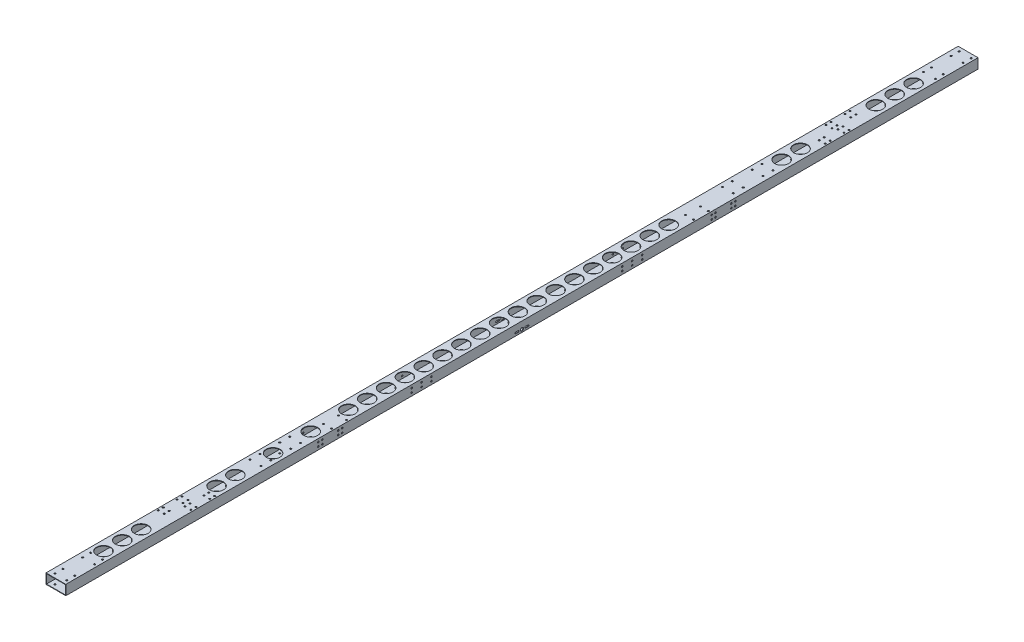
from build123d import *

# Parameters (mm, degrees)
SKETCH_1_W          = 40
SKETCH_1_H          = 20
SKETCH_1_W_2        = 38
SKETCH_1_H_2        = 18
EXTRUDE_1_DEPTH     = 1840
SKETCH_2_R          = 1.6
CUT_EXTRUDE_1_DEPTH = 1841.543398021
SKETCH_3_R          = 1.6
CUT_EXTRUDE_2_DEPTH = 1841.543398021
SKETCH_4_R          = 3.1
CUT_EXTRUDE_3_DEPTH = 1841.543398021
SKETCH_5_R          = 1.6
CUT_EXTRUDE_4_DEPTH = 1841.543398021
SKETCH_6_R          = 14
CUT_EXTRUDE_5_DEPTH = 1841.543398021


with BuildPart() as part:
    # 草图1 → 凸台-拉伸1 (new body)
    with BuildSketch(Plane.XY):
        with Locations((20, 10)):
            Rectangle(SKETCH_1_W, SKETCH_1_H)
        with Locations((20, 10)):
            Rectangle(SKETCH_1_W_2, SKETCH_1_H_2, mode=Mode.SUBTRACT)
    extrude(amount=EXTRUDE_1_DEPTH)

    # 草图2 → 切除-拉伸1 (cut, through all)
    with BuildSketch(Plane.XZ):
        with Locations(Location((34, 8, 0), (0, 0, 270))):
            Circle(SKETCH_2_R)
        with Locations(Location((34, 24, 0), (0, 0, 270))):
            Circle(SKETCH_2_R)
        with Locations(Location((34, 64, 0), (0, 0, 270))):
            Circle(SKETCH_2_R)
        with Locations(Location((34, 80, 0), (0, 0, 270))):
            Circle(SKETCH_2_R)
        with Locations(Location((10, 64, 0), (0, 0, 270))):
            Circle(SKETCH_2_R)
        with Locations(Location((10, 80, 0), (0, 0, 270))):
            Circle(SKETCH_2_R)
        with Locations(Location((10, 24, 0), (0, 0, 270))):
            Circle(SKETCH_2_R)
        with Locations(Location((10, 8, 0), (0, 0, 270))):
            Circle(SKETCH_2_R)
        with Locations(Location((4, 232.506350946, 0), (0, 0, 270))):
            Circle(SKETCH_2_R)
        with Locations(Location((16, 270.506350946, 0), (0, 0, 270))):
            Circle(SKETCH_2_R)
        with Locations(Location((4, 270.506350946, 0), (0, 0, 270))):
            Circle(SKETCH_2_R)
        with Locations(Location((16, 222.506350946, 0), (0, 0, 270))):
            Circle(SKETCH_2_R)
        with Locations(Location((4, 222.506350946, 0), (0, 0, 270))):
            Circle(SKETCH_2_R)
        with Locations(Location((16, 260.506350946, 0), (0, 0, 270))):
            Circle(SKETCH_2_R)
        with Locations(Location((4, 260.506350946, 0), (0, 0, 270))):
            Circle(SKETCH_2_R)
        with Locations(Location((16, 232.506350946, 0), (0, 0, 270))):
            Circle(SKETCH_2_R)
        with Locations(Location((8, 483.5, 0), (0, 0, 270))):
            Circle(SKETCH_2_R)
        with Locations(Location((30, 483.5, 0), (0, 0, 270))):
            Circle(SKETCH_2_R)
        with Locations(Location((30, 463.5, 0), (0, 0, 270))):
            Circle(SKETCH_2_R)
        with Locations(Location((30, 423.5, 0), (0, 0, 270))):
            Circle(SKETCH_2_R)
        with Locations(Location((8, 403.5, 0), (0, 0, 270))):
            Circle(SKETCH_2_R)
        with Locations(Location((30, 403.5, 0), (0, 0, 270))):
            Circle(SKETCH_2_R)
        with Locations(Location((8, 423.5, 0), (0, 0, 270))):
            Circle(SKETCH_2_R)
        with Locations(Location((8, 463.5, 0), (0, 0, 270))):
            Circle(SKETCH_2_R)
        with Locations(Location((8, 1436.5, 0), (0, 0, 270))):
            Circle(SKETCH_2_R)
        with Locations(Location((30, 1436.5, 0), (0, 0, 270))):
            Circle(SKETCH_2_R)
        with Locations(Location((30, 1416.5, 0), (0, 0, 270))):
            Circle(SKETCH_2_R)
        with Locations(Location((30, 1376.5, 0), (0, 0, 270))):
            Circle(SKETCH_2_R)
        with Locations(Location((8, 1356.5, 0), (0, 0, 270))):
            Circle(SKETCH_2_R)
        with Locations(Location((30, 1356.5, 0), (0, 0, 270))):
            Circle(SKETCH_2_R)
        with Locations(Location((8, 1376.5, 0), (0, 0, 270))):
            Circle(SKETCH_2_R)
        with Locations(Location((8, 1416.5, 0), (0, 0, 270))):
            Circle(SKETCH_2_R)
        with Locations(Location((4, 1607.493649054, 0), (0, 0, 270))):
            Circle(SKETCH_2_R)
        with Locations(Location((16, 1569.493649054, 0), (0, 0, 270))):
            Circle(SKETCH_2_R)
        with Locations(Location((4, 1569.493649054, 0), (0, 0, 270))):
            Circle(SKETCH_2_R)
        with Locations(Location((16, 1617.493649054, 0), (0, 0, 270))):
            Circle(SKETCH_2_R)
        with Locations(Location((4, 1617.493649054, 0), (0, 0, 270))):
            Circle(SKETCH_2_R)
        with Locations(Location((16, 1579.493649054, 0), (0, 0, 270))):
            Circle(SKETCH_2_R)
        with Locations(Location((4, 1579.493649054, 0), (0, 0, 270))):
            Circle(SKETCH_2_R)
        with Locations(Location((16, 1607.493649054, 0), (0, 0, 270))):
            Circle(SKETCH_2_R)
        with Locations(Location((34, 1832, 0), (0, 0, 270))):
            Circle(SKETCH_2_R)
        with Locations(Location((34, 1816, 0), (0, 0, 270))):
            Circle(SKETCH_2_R)
        with Locations(Location((34, 1776, 0), (0, 0, 270))):
            Circle(SKETCH_2_R)
        with Locations(Location((34, 1760, 0), (0, 0, 270))):
            Circle(SKETCH_2_R)
        with Locations(Location((10, 1776, 0), (0, 0, 270))):
            Circle(SKETCH_2_R)
        with Locations(Location((10, 1760, 0), (0, 0, 270))):
            Circle(SKETCH_2_R)
        with Locations(Location((10, 1816, 0), (0, 0, 270))):
            Circle(SKETCH_2_R)
        with Locations(Location((10, 1832, 0), (0, 0, 270))):
            Circle(SKETCH_2_R)
    extrude(amount=-CUT_EXTRUDE_1_DEPTH, mode=Mode.SUBTRACT)

    # 草图3 → 切除-拉伸2 (cut, through all)
    with BuildSketch(Plane.XZ):
        with Locations(Location((20, 1270, 0), (0, 0, 270))):
            Circle(SKETCH_3_R)
        with Locations(Location((20, 1300, 0), (0, 0, 270))):
            Circle(SKETCH_3_R)
        with Locations(Location((36, 1300, 0), (0, 0, 270))):
            Circle(SKETCH_3_R)
        with Locations(Location((36, 294.294919243, 0), (0, 0, 270))):
            Circle(SKETCH_3_R)
        with Locations(Location((24, 256.294919243, 0), (0, 0, 270))):
            Circle(SKETCH_3_R)
        with Locations(Location((36, 256.294919243, 0), (0, 0, 270))):
            Circle(SKETCH_3_R)
        with Locations(Location((24, 304.294919243, 0), (0, 0, 270))):
            Circle(SKETCH_3_R)
        with Locations(Location((36, 304.294919243, 0), (0, 0, 270))):
            Circle(SKETCH_3_R)
        with Locations(Location((24, 266.294919243, 0), (0, 0, 270))):
            Circle(SKETCH_3_R)
        with Locations(Location((36, 266.294919243, 0), (0, 0, 270))):
            Circle(SKETCH_3_R)
        with Locations(Location((24, 294.294919243, 0), (0, 0, 270))):
            Circle(SKETCH_3_R)
        with Locations(Location((36, 1270, 0), (0, 0, 270))):
            Circle(SKETCH_3_R)
        with Locations(Location((20, 540, 0), (0, 0, 270))):
            Circle(SKETCH_3_R)
        with Locations(Location((36, 1545.705080757, 0), (0, 0, 270))):
            Circle(SKETCH_3_R)
        with Locations(Location((24, 1583.705080757, 0), (0, 0, 270))):
            Circle(SKETCH_3_R)
        with Locations(Location((36, 1583.705080757, 0), (0, 0, 270))):
            Circle(SKETCH_3_R)
        with Locations(Location((24, 1535.705080757, 0), (0, 0, 270))):
            Circle(SKETCH_3_R)
        with Locations(Location((36, 1535.705080757, 0), (0, 0, 270))):
            Circle(SKETCH_3_R)
        with Locations(Location((24, 1573.705080757, 0), (0, 0, 270))):
            Circle(SKETCH_3_R)
        with Locations(Location((36, 1573.705080757, 0), (0, 0, 270))):
            Circle(SKETCH_3_R)
        with Locations(Location((24, 1545.705080757, 0), (0, 0, 270))):
            Circle(SKETCH_3_R)
        with Locations(Location((36, 540, 0), (0, 0, 270))):
            Circle(SKETCH_3_R)
        with Locations(Location((20, 570, 0), (0, 0, 270))):
            Circle(SKETCH_3_R)
        with Locations(Location((36, 570, 0), (0, 0, 270))):
            Circle(SKETCH_3_R)
    extrude(amount=-CUT_EXTRUDE_2_DEPTH, mode=Mode.SUBTRACT)

    # 草图4 → 切除-拉伸3 (cut, through all)
    with BuildSketch(Plane(origin=(40, 0, 0), x_dir=(0, 0, -1), z_dir=(1, 0, 0))):
        with Locations((-920, 5.5)):
            Circle(SKETCH_4_R)
        with BuildLine():
            Line((-907.5, 7), (-912.5, 7))
            ThreePointArc((-912.5, 7), (-914, 5.5), (-912.5, 4))
            Line((-912.5, 4), (-907.5, 4))
            ThreePointArc((-907.5, 4), (-906, 5.5), (-907.5, 7))
        make_face()
        with BuildLine():
            Line((-927.5, 7), (-932.5, 7))
            ThreePointArc((-932.5, 7), (-934, 5.5), (-932.5, 4))
            Line((-932.5, 4), (-927.5, 4))
            ThreePointArc((-927.5, 4), (-926, 5.5), (-927.5, 7))
        make_face()
    extrude(amount=-CUT_EXTRUDE_3_DEPTH, mode=Mode.SUBTRACT)

    # 草图5 → 切除-拉伸4 (cut, through all)
    with BuildSketch(Plane.ZY):
        with Locations((537.5, 6)):
            Circle(SKETCH_5_R)
        with Locations((537.5, 14)):
            Circle(SKETCH_5_R)
        with Locations((497.5, 6)):
            Circle(SKETCH_5_R)
        with Locations((497.5, 14)):
            Circle(SKETCH_5_R)
        with Locations((489.5, 6)):
            Circle(SKETCH_5_R)
        with Locations((489.5, 14)):
            Circle(SKETCH_5_R)
        with Locations((529.5, 14)):
            Circle(SKETCH_5_R)
        with Locations((529.5, 6)):
            Circle(SKETCH_5_R)
        with Locations((1282.5, 6)):
            Circle(SKETCH_5_R)
        with Locations((1282.5, 14)):
            Circle(SKETCH_5_R)
        with Locations((1322.5, 6)):
            Circle(SKETCH_5_R)
        with Locations((1322.5, 14)):
            Circle(SKETCH_5_R)
        with Locations((1330.5, 6)):
            Circle(SKETCH_5_R)
        with Locations((1330.5, 14)):
            Circle(SKETCH_5_R)
        with Locations((1290.5, 14)):
            Circle(SKETCH_5_R)
        with Locations((1290.5, 6)):
            Circle(SKETCH_5_R)
        with Locations((677.5, 14)):
            Circle(SKETCH_5_R)
        with Locations((677.5, 6)):
            Circle(SKETCH_5_R)
        with Locations((697.5, 14)):
            Circle(SKETCH_5_R)
        with Locations((697.5, 6)):
            Circle(SKETCH_5_R)
        with Locations((717.5, 14)):
            Circle(SKETCH_5_R)
        with Locations((717.5, 6)):
            Circle(SKETCH_5_R)
        with Locations((1142.5, 14)):
            Circle(SKETCH_5_R)
        with Locations((1142.5, 6)):
            Circle(SKETCH_5_R)
        with Locations((1122.5, 14)):
            Circle(SKETCH_5_R)
        with Locations((1122.5, 6)):
            Circle(SKETCH_5_R)
        with Locations((1102.5, 14)):
            Circle(SKETCH_5_R)
        with Locations((1102.5, 6)):
            Circle(SKETCH_5_R)
    extrude(amount=-CUT_EXTRUDE_4_DEPTH, mode=Mode.SUBTRACT)

    # 草图6 → 切除-拉伸5 (cut, through all)
    with BuildSketch(Plane(origin=(0, 20, 0), x_dir=(1, 0, 0), z_dir=(0, 1, 0))):
        with Locations(Location((20, -110, 0), (0, 0, 270))):
            Circle(SKETCH_6_R)
        with Locations(Location((20, -148, 0), (0, 0, 270))):
            Circle(SKETCH_6_R)
        with Locations(Location((20, -186, 0), (0, 0, 270))):
            Circle(SKETCH_6_R)
        with Locations(Location((20, -338, 0), (0, 0, 270))):
            Circle(SKETCH_6_R)
        with Locations(Location((20, -376, 0), (0, 0, 270))):
            Circle(SKETCH_6_R)
        with Locations(Location((20, -604, 0), (0, 0, 270))):
            Circle(SKETCH_6_R)
        with Locations(Location((20, -642, 0), (0, 0, 270))):
            Circle(SKETCH_6_R)
        with Locations(Location((20, -680, 0), (0, 0, 270))):
            Circle(SKETCH_6_R)
        with Locations(Location((20, -718, 0), (0, 0, 270))):
            Circle(SKETCH_6_R)
        with Locations(Location((20, -756, 0), (0, 0, 270))):
            Circle(SKETCH_6_R)
        with Locations(Location((20, -794, 0), (0, 0, 270))):
            Circle(SKETCH_6_R)
        with Locations(Location((20, -832, 0), (0, 0, 270))):
            Circle(SKETCH_6_R)
        with Locations(Location((20, -870, 0), (0, 0, 270))):
            Circle(SKETCH_6_R)
        with Locations(Location((20, -908, 0), (0, 0, 270))):
            Circle(SKETCH_6_R)
        with Locations(Location((20, -946, 0), (0, 0, 270))):
            Circle(SKETCH_6_R)
        with Locations(Location((20, -984, 0), (0, 0, 270))):
            Circle(SKETCH_6_R)
        with Locations(Location((20, -1022, 0), (0, 0, 270))):
            Circle(SKETCH_6_R)
        with Locations(Location((20, -1060, 0), (0, 0, 270))):
            Circle(SKETCH_6_R)
        with Locations(Location((20, -1098, 0), (0, 0, 270))):
            Circle(SKETCH_6_R)
        with Locations(Location((20, -1136, 0), (0, 0, 270))):
            Circle(SKETCH_6_R)
        with Locations(Location((20, -1174, 0), (0, 0, 270))):
            Circle(SKETCH_6_R)
        with Locations(Location((20, -1212, 0), (0, 0, 270))):
            Circle(SKETCH_6_R)
        with Locations(Location((20, -1250, 0), (0, 0, 270))):
            Circle(SKETCH_6_R)
        with Locations(Location((20, -1326, 0), (0, 0, 270))):
            Circle(SKETCH_6_R)
        with Locations(Location((20, -1402, 0), (0, 0, 270))):
            Circle(SKETCH_6_R)
        with Locations(Location((20, -1478, 0), (0, 0, 270))):
            Circle(SKETCH_6_R)
        with Locations(Location((20, -1516, 0), (0, 0, 270))):
            Circle(SKETCH_6_R)
        with Locations(Location((20, -1668, 0), (0, 0, 270))):
            Circle(SKETCH_6_R)
        with Locations(Location((20, -1706, 0), (0, 0, 270))):
            Circle(SKETCH_6_R)
        with Locations(Location((20, -1744, 0), (0, 0, 270))):
            Circle(SKETCH_6_R)
    extrude(amount=-CUT_EXTRUDE_5_DEPTH, mode=Mode.SUBTRACT)


solid = part.part
